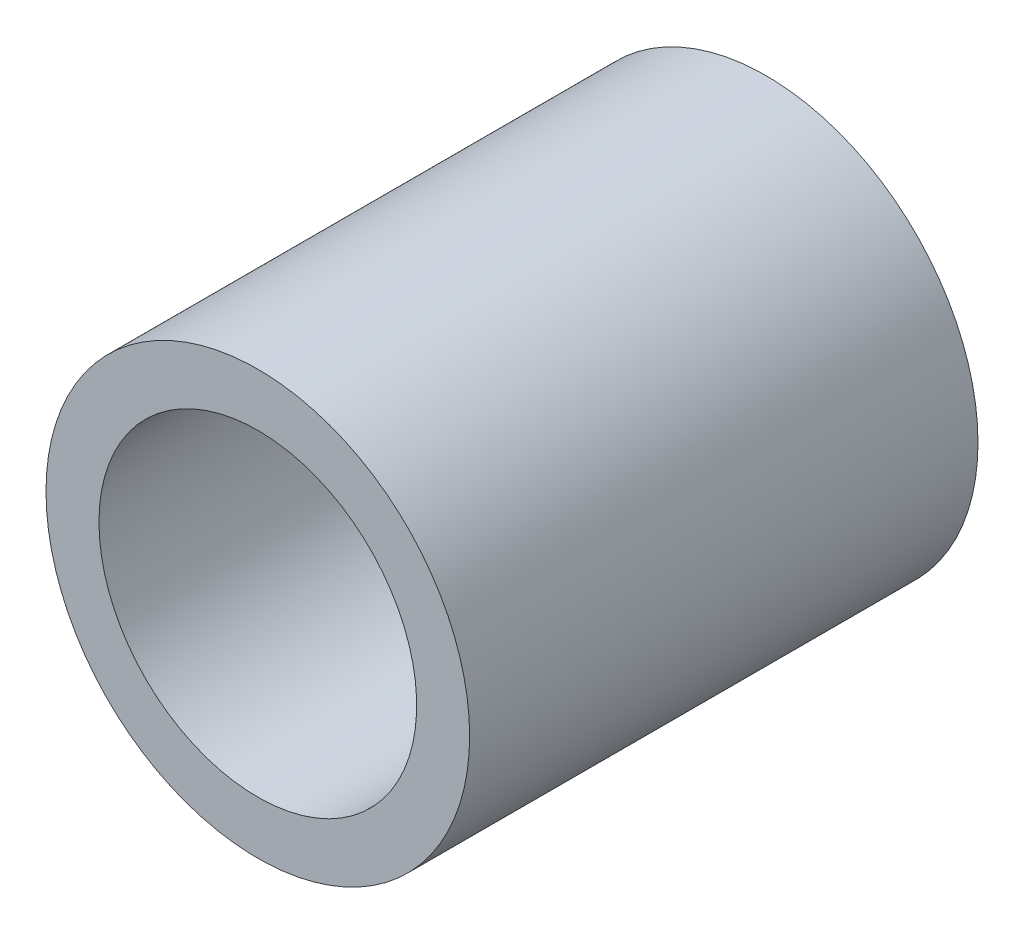
from build123d import *

# Parameters (mm, degrees)
SKETCH1_R           = 2.54
SKETCH1_R_2         = 1.905
BOSS_EXTRUDE1_DEPTH = 6.096


with BuildPart() as part:
    # Sketch1 → Boss-Extrude1 (new body)
    with BuildSketch(Plane.XY):
        with Locations(Location((0, 0, 0), (0, 0, 180))):
            Circle(SKETCH1_R)
        with Locations(Location((0, 0, 0), (0, 0, 180))):
            Circle(SKETCH1_R_2, mode=Mode.SUBTRACT)
    extrude(amount=BOSS_EXTRUDE1_DEPTH)


solid = part.part
